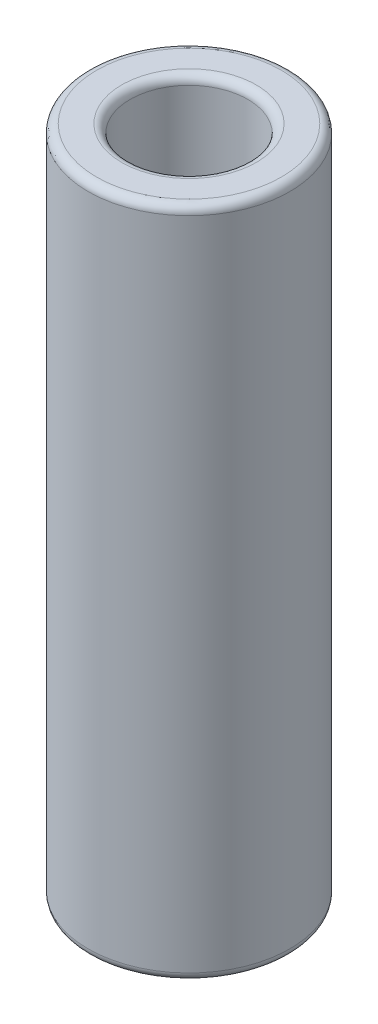
from build123d import *

# Parameters (mm, degrees)
SZKIC1_R                    = 6
SZKIC1_R_2                  = 3.5
DODANIE_WYCI_GNI_CIE2_DEPTH = 40
ZAOKR_GLENIE1_R             = 0.5
ZAOKR_GLENIE2_R             = 0.5


with BuildPart() as part:
    # Szkic1 → Dodanie-wyciągnięcie2 (new body)
    with BuildSketch(Plane(origin=(0, 0, 0), x_dir=(1, 0, 0), z_dir=(0, 1, 0))):
        with Locations(Location((0, 0, 0), (0, 0, 270))):
            Circle(SZKIC1_R)
        with Locations(Location((0, 0, 0), (0, 0, 270))):
            Circle(SZKIC1_R_2, mode=Mode.SUBTRACT)
    extrude(amount=DODANIE_WYCI_GNI_CIE2_DEPTH)

    # Zaokrąglenie1
    zaokr_glenie1_edges = [part.edges().sort_by_distance(p)[0] for p in [
        (0, 40, -6),
        (0, 40, -3.5),
    ]]
    fillet(zaokr_glenie1_edges, radius=ZAOKR_GLENIE1_R)

    # Zaokrąglenie2
    zaokr_glenie2_edges = [part.edges().sort_by_distance(p)[0] for p in [
        (0, 0, -6),
        (0, 0, -3.5),
    ]]
    fillet(zaokr_glenie2_edges, radius=ZAOKR_GLENIE2_R)


solid = part.part
